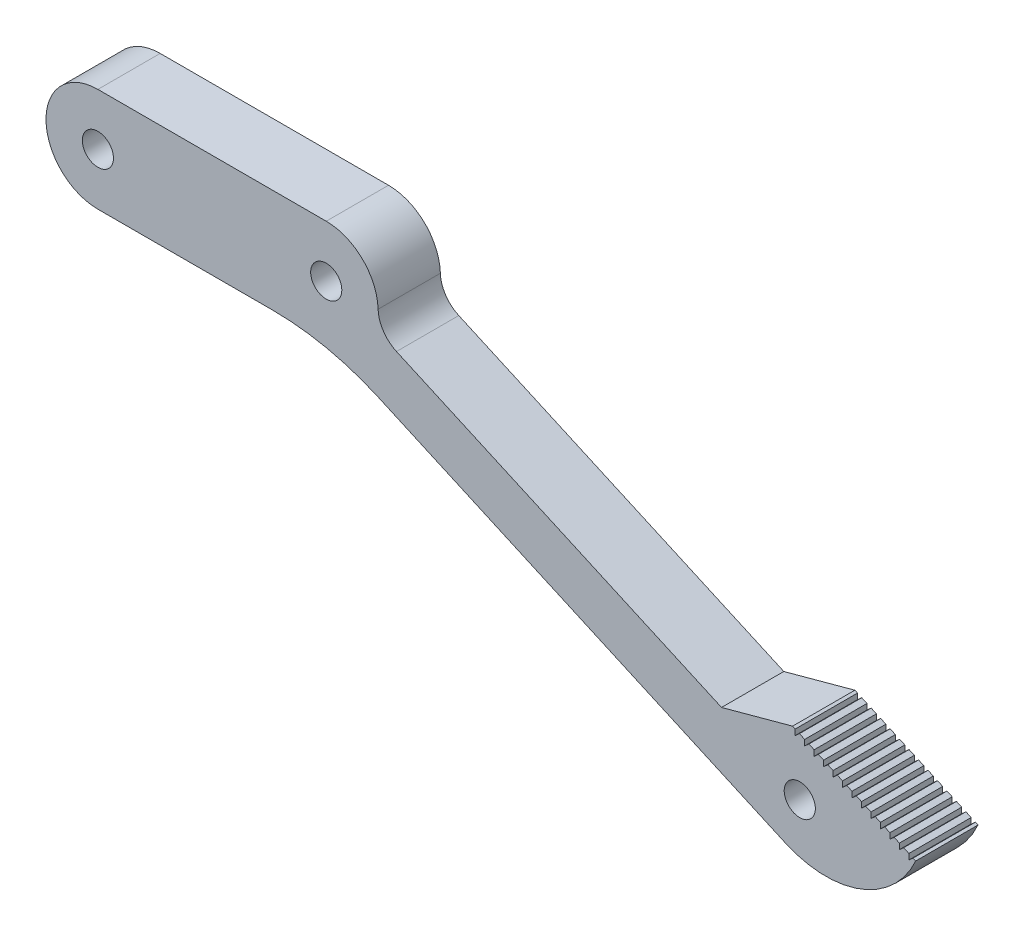
from build123d import *

# Parameters (mm, degrees)
SKETCH_1_R             = 1.5
EXTRUDE_1_DEPTH        = 6
EXTRUDE_START          = -6
SKETCH_2_R             = 1.5
EXTRUDE_2_DEPTH        = 6
CUT_EXTRUDE_1_DEPTH    = 6
PATTERN_LINEAR_1_COUNT = 13
PATTERN_LINEAR_1_PITCH = 1


with BuildPart() as part:
    # 草图1 → 凸台-拉伸1 (new body)
    with BuildSketch(Plane.XY):
        with BuildLine():
            Line((-11, 5), (11, 5))
            ThreePointArc((11, 5), (16, 0), (11, -5))
            Line((11, -5), (-11, -5))
            ThreePointArc((-11, -5), (-16, 0), (-11, 5))
        make_face()
        with Locations((-11, 0)):
            Circle(SKETCH_1_R, mode=Mode.SUBTRACT)
        with Locations((11, 0)):
            Circle(SKETCH_1_R, mode=Mode.SUBTRACT)
    extrude(amount=EXTRUDE_1_DEPTH)

    # 草图2 → 凸台-拉伸2 (add)
    with BuildSketch(Plane.XY.offset(6).offset(EXTRUDE_START)):
        with BuildLine():
            Line((17.768794041, -2.486649801), (49.086461827, -16.527047167))
            Line((49.086461827, -16.527047167), (55.932655241, -14.664804568))
            Line((55.932655241, -14.664804568), (67.795072454, -19.982986386))
            ThreePointArc((67.795072454, -19.982986386), (62.507998002, -24.974385962), (55.240019316, -24.765312252))
            Line((55.240019316, -24.765312252), (16.032361282, -7.187659205))
            ThreePointArc((16.032361282, -7.187659205), (11.034404004, -5.553031682), (5.805088555, -5))
            Line((5.805088555, -5), (11, -5))
            ThreePointArc((11, -5), (14.590532493, -3.479666135), (15.99754173, 0.156769434))
            ThreePointArc((15.99754173, 0.156769434), (16.503827213, -1.419121599), (17.768794041, -2.486649801))
        make_face()
        with Locations((56.624681591, -20.454545455)):
            Circle(SKETCH_2_R, mode=Mode.SUBTRACT)
    extrude(amount=EXTRUDE_2_DEPTH)

    # 草图3 → 切除-拉伸1 (cut)
    with BuildSketch(Plane.XY.offset(6)):
        Polygon((67.543371093, -19.870143145), (67.134280184, -20.234687748), (67.134280184, -19.686738718), align=None)
    cut_extrude_1 = extrude(amount=-CUT_EXTRUDE_1_DEPTH, mode=Mode.SUBTRACT)

    # 阵列(线性)1: 切除-拉伸1 ×13
    with Locations(*[Vector(-0.9124936318129441, 0.40909090909090523, 0) * (i * PATTERN_LINEAR_1_PITCH) for i in range(1, PATTERN_LINEAR_1_COUNT)]):
        add(cut_extrude_1, mode=Mode.SUBTRACT)


solid = part.part
